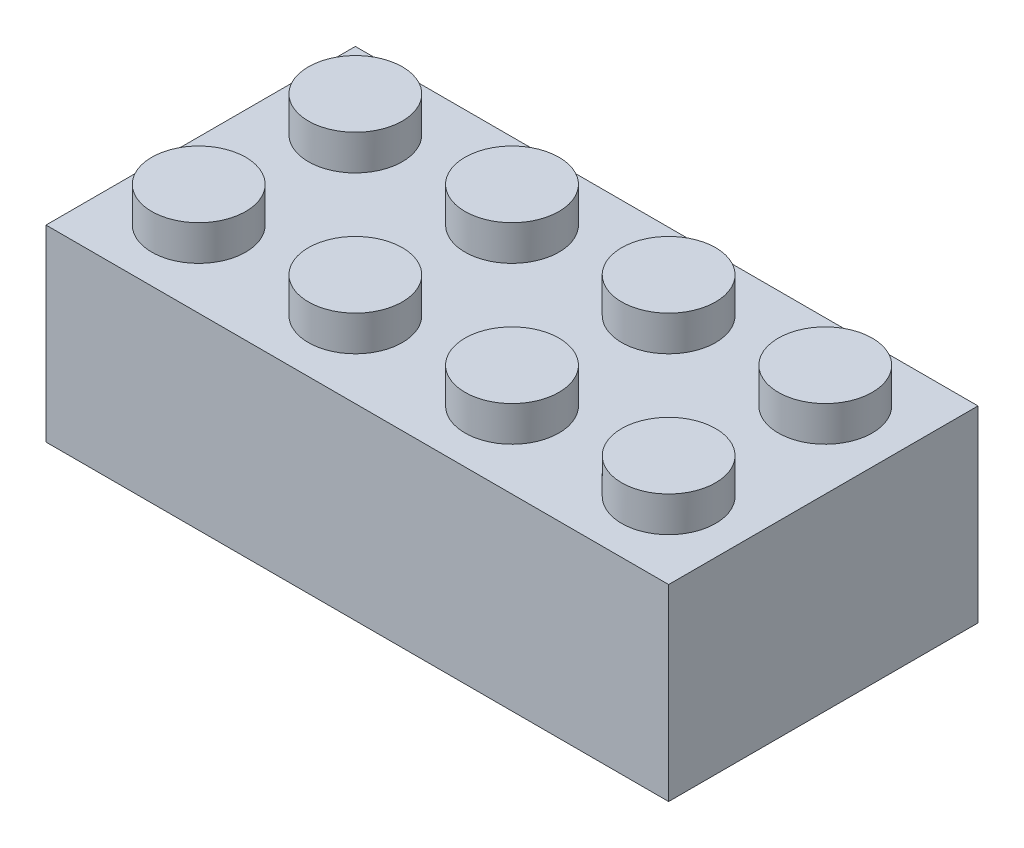
from build123d import *

# Parameters (mm, degrees)
SKETCH1_W           = 31.8
SKETCH1_H           = 15.8
BOSS_EXTRUDE1_DEPTH = 9.6
SKETCH2_W           = 29
SKETCH2_H           = 13.4
CUT_EXTRUDE1_DEPTH  = 8.6
SKETCH3_R           = 2.4
BOSS_EXTRUDE2_DEPTH = 2.8
SKETCH3_3_R         = 1.3
CUT_EXTRUDE2_DEPTH  = 1.7
SKETCH4_R           = 3.25
SKETCH4_R_2         = 2.05
BOSS_EXTRUDE3_DEPTH = 8.6
RIB1_REACH          = 21.951
SKETCH5_WALLS_W     = 1.1
SKETCH5_WALLS_H     = 45.351378422
SKETCH6_W           = 1.2
SKETCH6_H           = 0.2
SKETCH6_W_2         = 0.2
SKETCH6_H_2         = 1.2
BOSS_EXTRUDE4_DEPTH = 8.6


with BuildPart() as part:
    # Sketch1 → Boss-Extrude1 (new body)
    with BuildSketch(Plane(origin=(0, 0, 0), x_dir=(1, 0, 0), z_dir=(0, 1, 0))):
        Rectangle(SKETCH1_W, SKETCH1_H)
    extrude(amount=BOSS_EXTRUDE1_DEPTH)

    # Sketch2 → Cut-Extrude1 (cut)
    with BuildSketch(Plane.XZ):
        Rectangle(SKETCH2_W, SKETCH2_H)
    extrude(amount=-CUT_EXTRUDE1_DEPTH, mode=Mode.SUBTRACT)

    # Sketch3 → Boss-Extrude2 (add)
    with BuildSketch(Plane.XZ.offset(-8.6)):
        with Locations(Location((-12, 4, 0), (0, 0, 270))):
            Circle(SKETCH3_R)
        with Locations(Location((-4, 4, 0), (0, 0, 270))):
            Circle(SKETCH3_R)
        with Locations(Location((4, 4, 0), (0, 0, 270))):
            Circle(SKETCH3_R)
        with Locations(Location((12, 4, 0), (0, 0, 270))):
            Circle(SKETCH3_R)
        with Locations(Location((12, -4, 0), (0, 0, 270))):
            Circle(SKETCH3_R)
        with Locations(Location((4, -4, 0), (0, 0, 270))):
            Circle(SKETCH3_R)
        with Locations(Location((-4, -4, 0), (0, 0, 270))):
            Circle(SKETCH3_R)
        with Locations(Location((-12, -4, 0), (0, 0, 270))):
            Circle(SKETCH3_R)
    extrude(amount=-BOSS_EXTRUDE2_DEPTH)

    # Sketch3<3> → Cut-Extrude2 (cut)
    with BuildSketch(Plane.XZ.offset(-8.6)):
        with Locations(Location((-12, 4, 0), (0, 0, 270))):
            Circle(SKETCH3_3_R)
        with Locations(Location((-4, 4, 0), (0, 0, 270))):
            Circle(SKETCH3_3_R)
        with Locations(Location((4, 4, 0), (0, 0, 270))):
            Circle(SKETCH3_3_R)
        with Locations(Location((12, 4, 0), (0, 0, 270))):
            Circle(SKETCH3_3_R)
        with Locations(Location((12, -4, 0), (0, 0, 270))):
            Circle(SKETCH3_3_R)
        with Locations(Location((4, -4, 0), (0, 0, 270))):
            Circle(SKETCH3_3_R)
        with Locations(Location((-4, -4, 0), (0, 0, 270))):
            Circle(SKETCH3_3_R)
        with Locations(Location((-12, -4, 0), (0, 0, 270))):
            Circle(SKETCH3_3_R)
    extrude(amount=-CUT_EXTRUDE2_DEPTH, mode=Mode.SUBTRACT)

    # Sketch4 → Boss-Extrude3 (add)
    # profile 1 of 3: a face of its own
    with BuildSketch(Plane.XZ.offset(-8.6)):
        with Locations(Location((0, 0, 0), (0, 0, 90))):
            Circle(SKETCH4_R)
        with Locations(Location((0, 0, 0), (0, 0, 90))):
            Circle(SKETCH4_R_2, mode=Mode.SUBTRACT)
    # profile 2 of 3: a face of its own
    with BuildSketch(Plane.XZ.offset(-8.6)):
        with Locations(Location((-8, 0, 0), (0, 0, 90))):
            Circle(SKETCH4_R)
        with Locations(Location((-8, 0, 0), (0, 0, 90))):
            Circle(SKETCH4_R_2, mode=Mode.SUBTRACT)
    # profile 3 of 3: a face of its own
    with BuildSketch(Plane.XZ.offset(-8.6)):
        with Locations(Location((8, 0, 0), (0, 0, 90))):
            Circle(SKETCH4_R)
        with Locations(Location((8, 0, 0), (0, 0, 90))):
            Circle(SKETCH4_R_2, mode=Mode.SUBTRACT)
    extrude(amount=BOSS_EXTRUDE3_DEPTH)

    # Sketch5 walls → Rib1 (add, up to next)
    with BuildSketch(Plane.XZ.offset(-2.3), mode=Mode.PRIVATE) as rib1_sk1:
        with Locations((0, 4.975)):
            Rectangle(SKETCH5_WALLS_W, SKETCH5_WALLS_H)
    rib1_tool1 = extrude(rib1_sk1.sketch, amount=-RIB1_REACH, mode=Mode.PRIVATE) - part.part
    # Sketch5 walls → Rib1 (add, up to next)
    with BuildSketch(Plane.XZ.offset(-2.3), mode=Mode.PRIVATE) as rib1_sk2:
        with Locations((0, -4.975)):
            Rectangle(SKETCH5_WALLS_W, SKETCH5_WALLS_H)
    rib1_tool2 = extrude(rib1_sk2.sketch, amount=-RIB1_REACH, mode=Mode.PRIVATE) - part.part
    add(rib1_tool1.solids().sort_by_distance((0, 2.3, 4.975))[0])
    add(rib1_tool2.solids().sort_by_distance((0, 2.3, -4.975))[0])

    # Sketch6 → Boss-Extrude4 (add)
    with BuildSketch(Plane.XZ):
        with Locations((-12, 6.6)):
            Rectangle(SKETCH6_W, SKETCH6_H)
        with Locations((-4, 6.6)):
            Rectangle(SKETCH6_W, SKETCH6_H)
        with Locations((4, 6.6)):
            Rectangle(SKETCH6_W, SKETCH6_H)
        with Locations((12, 6.6)):
            Rectangle(SKETCH6_W, SKETCH6_H)
        with Locations((12, -6.6)):
            Rectangle(SKETCH6_W, SKETCH6_H)
        with Locations((4, -6.6)):
            Rectangle(SKETCH6_W, SKETCH6_H)
        with Locations((-4, -6.6)):
            Rectangle(SKETCH6_W, SKETCH6_H)
        with Locations((-12, -6.6)):
            Rectangle(SKETCH6_W, SKETCH6_H)
        with Locations((-14.4, -4)):
            Rectangle(SKETCH6_W_2, SKETCH6_H_2)
        with Locations((-14.4, 4)):
            Rectangle(SKETCH6_W_2, SKETCH6_H_2)
        with Locations((14.4, -4)):
            Rectangle(SKETCH6_W_2, SKETCH6_H_2)
        with Locations((14.4, 4)):
            Rectangle(SKETCH6_W_2, SKETCH6_H_2)
    extrude(amount=-BOSS_EXTRUDE4_DEPTH)


solid = part.part
